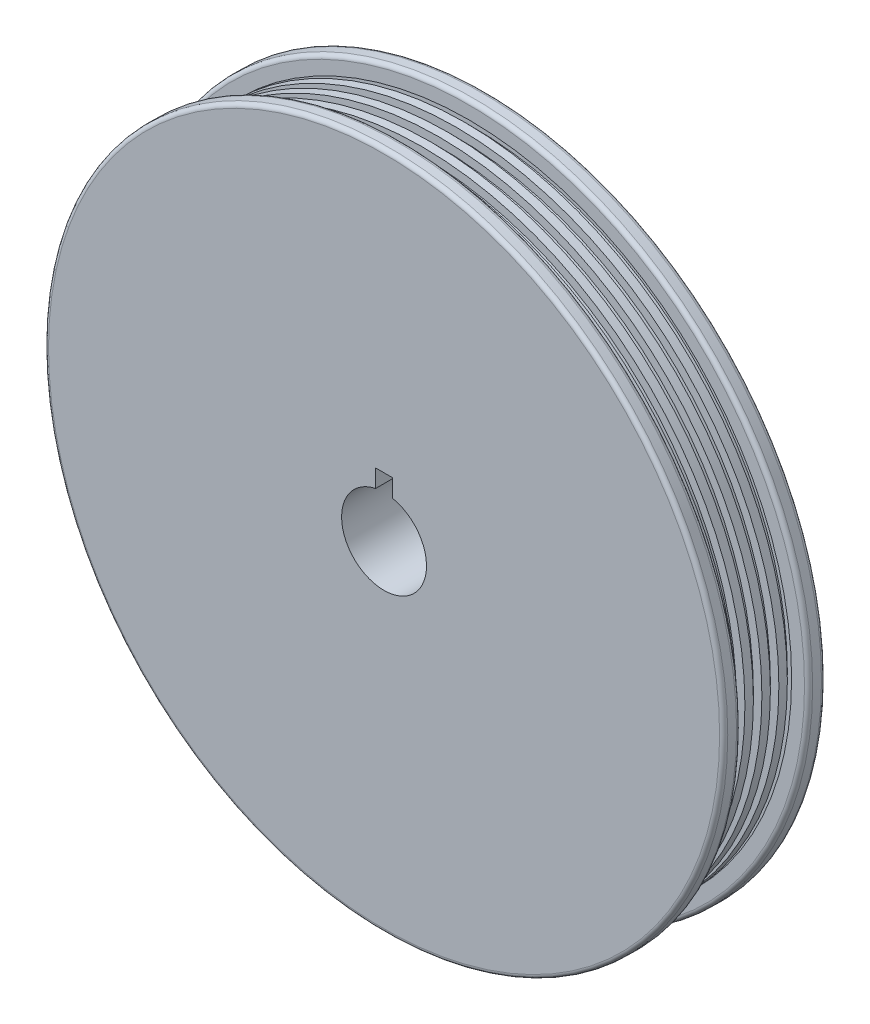
from build123d import *

# Parameters (mm, degrees)
SKETCH1_R           = 127
BOSS_EXTRUDE1_DEPTH = 19.05
SKETCH2_R           = 127
SKETCH2_R_2         = 120.65
CUT_EXTRUDE1_DEPTH  = 12.7
FILLET1_R           = 1.524
SKETCH3_R           = 120.65
SKETCH3_R_2         = 117.475
CUT_EXTRUDE2_DEPTH  = 1.5875
LPATTERN1_COUNT     = 3
LPATTERN1_PITCH     = 6.35
LPATTERN1_COL_COUNT = 3
LPATTERN1_COL_PITCH = 6.35
CUT_EXTRUDE3_DEPTH  = 101.6


with BuildPart() as part:
    # Sketch1 → Boss-Extrude1 (new, symmetric)
    with BuildSketch(Plane.XY):
        with Locations(Location((0, 0, 0), (0, 0, 180))):
            Circle(SKETCH1_R)
    extrude(amount=BOSS_EXTRUDE1_DEPTH, both=True)

    # Sketch2 → Cut-Extrude1 (cut, symmetric)
    with BuildSketch(Plane.XY):
        with Locations(Location((0, 0, 0), (0, 0, 180))):
            Circle(SKETCH2_R)
        Circle(SKETCH2_R_2, mode=Mode.SUBTRACT)
    extrude(amount=CUT_EXTRUDE1_DEPTH, both=True, mode=Mode.SUBTRACT)

    # Fillet1
    fillet1_edges = [part.edges().sort_by_distance(p)[0] for p in [
        (127, 0, -19.05),
        (127, 0, 19.05),
        (127, 0, -12.7),
        (127, 0, 12.7),
    ]]
    fillet(fillet1_edges, radius=FILLET1_R)

    # Sketch3 → Cut-Extrude2 (cut, symmetric)
    with BuildSketch(Plane.XY):
        Circle(SKETCH3_R)
        Circle(SKETCH3_R_2, mode=Mode.SUBTRACT)
    cut_extrude2 = extrude(amount=CUT_EXTRUDE2_DEPTH, both=True, mode=Mode.SUBTRACT)

    # LPattern1: Cut-Extrude2 ×3
    with Locations(*[(0, 0, -i * LPATTERN1_PITCH) for i in range(1, LPATTERN1_COUNT)]):
        add(cut_extrude2, mode=Mode.SUBTRACT)

    # LPattern1 col: Cut-Extrude2 ×3
    with Locations(*[(0, 0, i * LPATTERN1_COL_PITCH) for i in range(1, LPATTERN1_COL_COUNT)]):
        add(cut_extrude2, mode=Mode.SUBTRACT)

    # Sketch4 → Cut-Extrude3 (cut)
    with BuildSketch(Plane.XY.offset(19.05)):
        with BuildLine():
            Line((-3.175, 22.225), (3.175, 22.225))
            Line((3.175, 22.225), (3.175, 15.554259867))
            ThreePointArc((3.175, 15.554259867), (0, -15.875), (-3.175, 15.554259867))
            Line((-3.175, 15.554259867), (-3.175, 22.225))
        make_face()
    extrude(amount=-CUT_EXTRUDE3_DEPTH, mode=Mode.SUBTRACT)


solid = part.part
